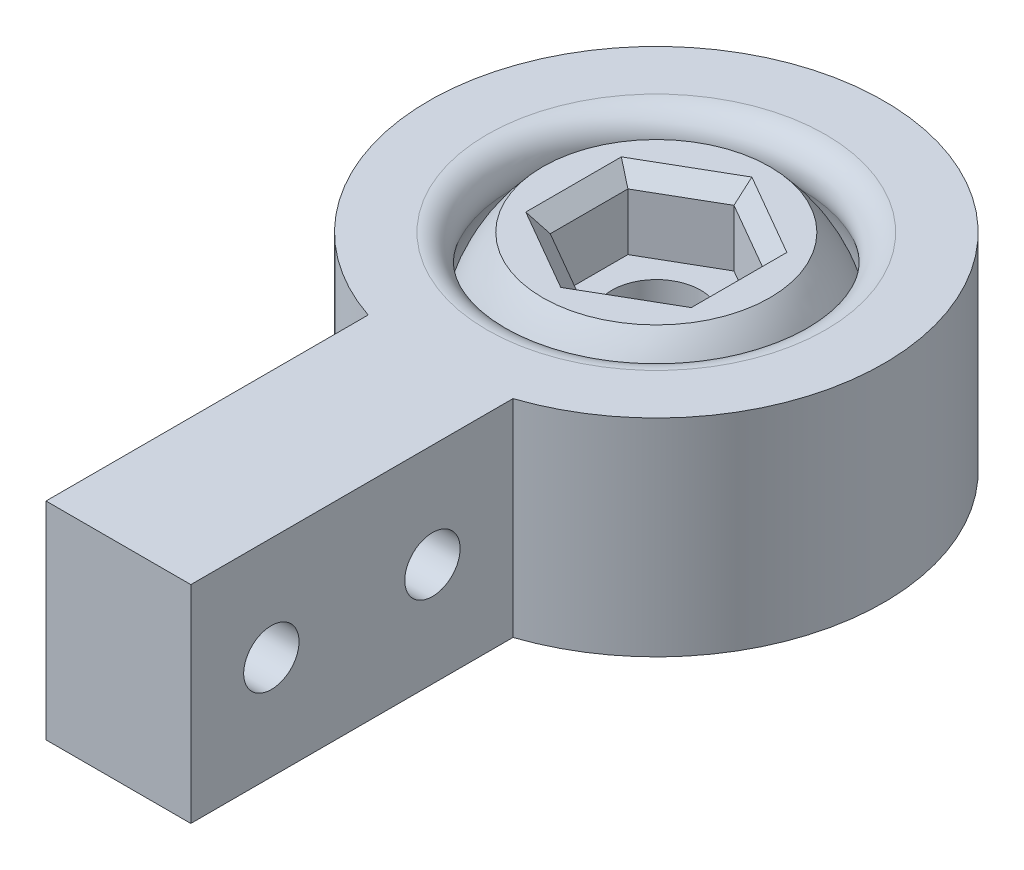
from build123d import *

# Parameters (mm, degrees)
SKETCH1_R                = 25
SKETCH1_R_2              = 15.5
SKETCH1_R_3              = 4.2
BOSS_EXTRUDE1_DEPTH      = 15
SKETCH3_R                = 25
CUT_EXTRUDE2_DEPTH       = 5
CUT_EXTRUDE3_START       = -5
SKETCH4_R                = 25
CUT_EXTRUDE3_DEPTH       = 5
CUT_EXTRUDE4_START       = 5
SKETCH6_R                = 25
CUT_EXTRUDE4_DEPTH       = 5
SKETCH7_R                = 25
CUT_EXTRUDE5_DEPTH       = 5
SKETCH8_R                = 4.2
CUT_EXTRUDE6_DEPTH       = 23
BOSS_EXTRUDE2_DEPTH      = 20
CUT_EXTRUDE7_DEPTH       = 50
CUT_EXTRUDE8_DEPTH       = 62.524385409
CUT_EXTRUDE8_DEPTH_BACK  = 62.524385409
SKETCH11_R               = 2.675
FILLET1_R                = 2.5
CUT_EXTRUDE9_DEPTH       = 7
SKETCH13_R               = 7.621023553
CUT_EXTRUDE10_DEPTH      = 7
CUT_EXTRUDE11_DEPTH      = 60.216741846
CUT_EXTRUDE11_DEPTH_BACK = 60.216741846
SKETCH14_R               = 4.3
CHAMFER1_SIZE            = 1.5


with BuildPart() as part:
    # Sketch1 → Boss-Extrude1 (new, symmetric)
    # profile 1 of 2: a face of its own
    with BuildSketch(Plane(origin=(0, 0, 0), x_dir=(1, 0, 0), z_dir=(0, 1, 0))):
        with Locations(Location((0, 0, 0), (0, 0, 270))):
            Circle(SKETCH1_R)
        Circle(SKETCH1_R_2, mode=Mode.SUBTRACT)
    # profile 2 of 2: a face of its own
    with BuildSketch(Plane(origin=(0, 0, 0), x_dir=(1, 0, 0), z_dir=(0, 1, 0))):
        Circle(SKETCH1_R_2)
        with Locations(Location((0, 0, 0), (0, 0, 270))):
            Circle(SKETCH1_R_3, mode=Mode.SUBTRACT)
    extrude(amount=BOSS_EXTRUDE1_DEPTH, both=True)

    # Sketch2 → Cut-Revolve3 (revolve, cut)
    with BuildSketch(Plane(origin=(0, 0, 0), x_dir=(1, 0, 0), z_dir=(0, 1, 0))):
        with BuildLine():
            Line((0, 15.5), (0, -15.5))
            ThreePointArc((0, -15.5), (15.5, 0), (0, 15.5))
        make_face()
    revolve(axis=Axis((0, 0, -15.5), (0, 0, 1)), mode=Mode.SUBTRACT)

    # Sketch3 → Cut-Extrude2 (cut)
    with BuildSketch(Plane(origin=(0, 15, 0), x_dir=(1, 0, 0), z_dir=(0, 1, 0))):
        with Locations(Location((0, 0, 0), (0, 0, 270))):
            Circle(SKETCH3_R)
    extrude(amount=-CUT_EXTRUDE2_DEPTH, mode=Mode.SUBTRACT)

    # Sketch4 → Cut-Extrude3 (cut)
    with BuildSketch(Plane.XZ.offset(15).offset(CUT_EXTRUDE3_START)):
        with Locations(Location((0, 0, 0), (0, 0, 270))):
            Circle(SKETCH4_R)
    extrude(amount=CUT_EXTRUDE3_DEPTH, mode=Mode.SUBTRACT)

    # Sketch9 → Boss-Extrude2 (add)
    with BuildSketch(Plane(origin=(0, 10, 0), x_dir=(1, 0, 0), z_dir=(0, 1, 0))):
        with BuildLine():
            Line((0, -55), (0, -25))
            ThreePointArc((0, -25), (-5.107741092, -24.472657823), (-10, -22.912878475))
            Line((-10, -22.912878475), (-10, -25))
            Line((-10, -25), (-10, -55))
            Line((-10, -55), (0, -55))
        make_face()
        with BuildLine():
            ThreePointArc((10, -22.912878475), (5.107741092, -24.472657823), (0, -25))
            Line((0, -25), (0, -55))
            Line((0, -55), (10, -55))
            Line((10, -55), (10, -25))
            Line((10, -25), (10, -22.912878475))
        make_face()
    extrude(amount=-BOSS_EXTRUDE2_DEPTH)

    # Sketch10 → Cut-Extrude7 (cut)
    with BuildSketch(Plane(origin=(0, 10, 0), x_dir=(1, 0, 0), z_dir=(0, 1, 0))):
        with BuildLine():
            Line((-10, -22.912878475), (-10, -55))
            Line((-10, -55), (10, -55))
            Line((10, -55), (10, -22.912878475))
            ThreePointArc((10, -22.912878475), (0, 25), (-10, -22.912878475))
        make_face()
        with BuildLine():
            Line((-7, -20.856653615), (-7, -52))
            Line((-7, -52), (7, -52))
            Line((7, -52), (7, -20.856653615))
            ThreePointArc((7, -20.856653615), (0, 22), (-7, -20.856653615))
        make_face(mode=Mode.SUBTRACT)
    extrude(amount=-CUT_EXTRUDE7_DEPTH, mode=Mode.SUBTRACT)

    # Sketch11 → Cut-Extrude8 (cut, two sides: drawn at the far end of the back side and taken through both)
    with BuildSketch(Plane(origin=(7, 0, 0), x_dir=(0, 0, -1), z_dir=(1, 0, 0)).offset(-CUT_EXTRUDE8_DEPTH_BACK)):
        with BuildLine():
            ThreePointArc((-41.539163404, 0), (-44.214163404, 2.675), (-46.889163404, 0))
            Line((-46.889163404, 0), (-41.539163404, 0))
        make_face()
        with BuildLine():
            Line((-41.539163404, 0), (-46.889163404, 0))
            ThreePointArc((-46.889163404, 0), (-44.214163404, -2.675), (-41.539163404, 0))
        make_face()
        with Locations((-28.642490211, 0)):
            Circle(SKETCH11_R)
    extrude(amount=CUT_EXTRUDE8_DEPTH + CUT_EXTRUDE8_DEPTH_BACK, mode=Mode.SUBTRACT)

    # Fillet1
    fillet1_edges = [part.edges().sort_by_distance(p)[0] for p in [
        (0, 10, -11.842719282),
        (0, -10, 11.842719282),
    ]]
    fillet(fillet1_edges, radius=FILLET1_R)


with BuildPart() as body_2:
    # Sketch5 → Revolve1 (revolve)
    with BuildSketch(Plane(origin=(0, 0, 0), x_dir=(1, 0, 0), z_dir=(0, 1, 0))):
        with BuildLine():
            Line((0, 14.85), (0, -14.85))
            ThreePointArc((0, -14.85), (14.85, 0), (0, 14.85))
        make_face()
    revolve(axis=Axis((0, 0, -14.85), (0, 0, 1)))

    # Sketch6 → Cut-Extrude4 (cut)
    with BuildSketch(Plane(origin=(0, 10, 0), x_dir=(1, 0, 0), z_dir=(0, 1, 0)).offset(CUT_EXTRUDE4_START)):
        with Locations(Location((0, 0, 0), (0, 0, 90))):
            Circle(SKETCH6_R)
    extrude(amount=-CUT_EXTRUDE4_DEPTH, mode=Mode.SUBTRACT)

    # Sketch7 → Cut-Extrude5 (cut)
    with BuildSketch(Plane.XZ.offset(10)):
        with Locations(Location((0, 0, 0), (0, 0, 270))):
            Circle(SKETCH7_R)
    extrude(amount=CUT_EXTRUDE5_DEPTH, mode=Mode.SUBTRACT)

    # Sketch8 → Cut-Extrude6 (cut)
    with BuildSketch(Plane(origin=(0, 10, 0), x_dir=(1, 0, 0), z_dir=(0, 1, 0))):
        with Locations(Location((0, 0, 0), (0, 0, 270))):
            Circle(SKETCH8_R)
    extrude(amount=-CUT_EXTRUDE6_DEPTH, mode=Mode.SUBTRACT)

    # Sketch12 → Cut-Extrude9 (cut)
    with BuildSketch(Plane(origin=(0, 10, 0), x_dir=(1, 0, 0), z_dir=(0, 1, 0))):
        Polygon((0, 7.505553499), (-6.5, 3.75277675), (-6.5, -3.75277675), (0, -7.505553499), (6.5, -3.75277675), (6.5, 3.75277675), align=None)
    extrude(amount=-CUT_EXTRUDE9_DEPTH, mode=Mode.SUBTRACT)

    # Sketch13 → Cut-Extrude10 (cut)
    with BuildSketch(Plane.XZ.offset(10)):
        with Locations(Location((0, 0, 0), (0, 0, 270))):
            Circle(SKETCH13_R)
    extrude(amount=-CUT_EXTRUDE10_DEPTH, mode=Mode.SUBTRACT)

    # Sketch14 → Cut-Extrude11 (cut, two sides: drawn at the far end of the back side and taken through both)
    with BuildSketch(Plane.XZ.offset(3).offset(-CUT_EXTRUDE11_DEPTH_BACK)):
        with Locations(Location((0, 0, 0), (0, 0, 90))):
            Circle(SKETCH14_R)
    extrude(amount=CUT_EXTRUDE11_DEPTH + CUT_EXTRUDE11_DEPTH_BACK, mode=Mode.SUBTRACT)

    # Chamfer1
    chamfer1_edges = [body_2.edges().sort_by_distance(p)[0] for p in [
        (3.25, 10, -5.629165125),
        (-3.25, 10, -5.629165125),
        (-6.5, 10, 0),
        (-3.25, 10, 5.629165125),
        (3.25, 10, 5.629165125),
        (6.5, 10, 0),
    ]]
    chamfer(chamfer1_edges, length=CHAMFER1_SIZE)


solid = Compound([part.part, body_2.part])
